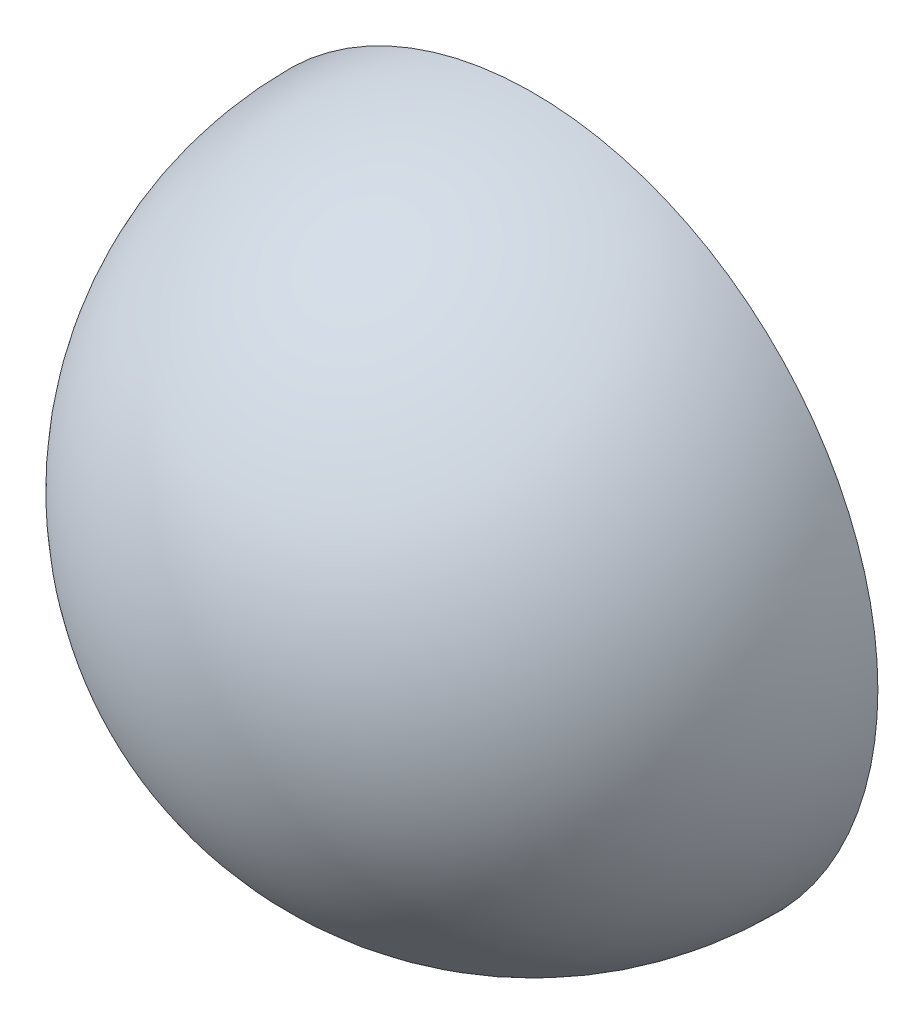
from build123d import *

# Parameters (mm, degrees)
REVOLVE1_ANGLE = 180


with BuildPart() as part:
    # Sketch1 → Revolve1 (revolve)
    with BuildSketch(Plane.XY):
        with BuildLine():
            Line((-9.697224365, 0), (9.697224365, 0))
            ThreePointArc((9.697224365, 0), (0, 9.697224365), (-9.697224365, 0))
        make_face()
    revolve(axis=Axis((-9.697224365, 0, 0), (1, 0, 0)), revolution_arc=REVOLVE1_ANGLE)


solid = part.part
